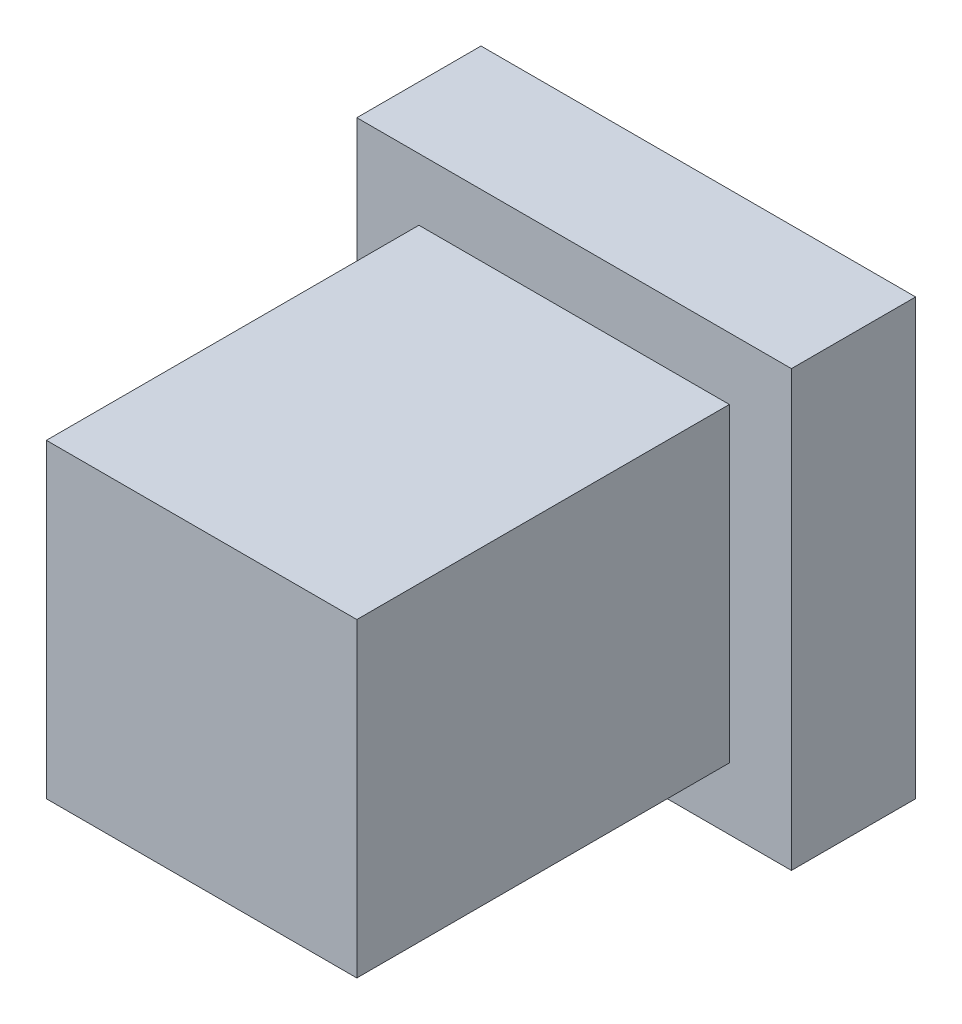
from build123d import *

# Parameters (mm, degrees)
SKETCH_1_W          = 5
SKETCH_1_H          = 5
EXTRUDE_1_DEPTH     = 8
SKETCH_2_W          = 7
SKETCH_2_H          = 7
EXTRUDE_2_DEPTH     = 2
SKETCH_3_R          = 1.5
CUT_EXTRUDE_1_DEPTH = 5


with BuildPart() as part:
    # 草图1 → 凸台-拉伸1 (new body)
    with BuildSketch(Plane.XY):
        Rectangle(SKETCH_1_W, SKETCH_1_H)
    extrude(amount=EXTRUDE_1_DEPTH)

    # 草图2 → 凸台-拉伸2 (add)
    with BuildSketch(Plane(origin=(0, 0, 0), x_dir=(-1, 0, 0), z_dir=(0, 0, -1))):
        Rectangle(SKETCH_2_W, SKETCH_2_H)
    extrude(amount=-EXTRUDE_2_DEPTH)

    # 草图3 → 切除-拉伸1 (cut)
    with BuildSketch(Plane(origin=(0, 0, 0), x_dir=(-1, 0, 0), z_dir=(0, 0, -1))):
        Circle(SKETCH_3_R)
    extrude(amount=-CUT_EXTRUDE_1_DEPTH, mode=Mode.SUBTRACT)


solid = part.part
